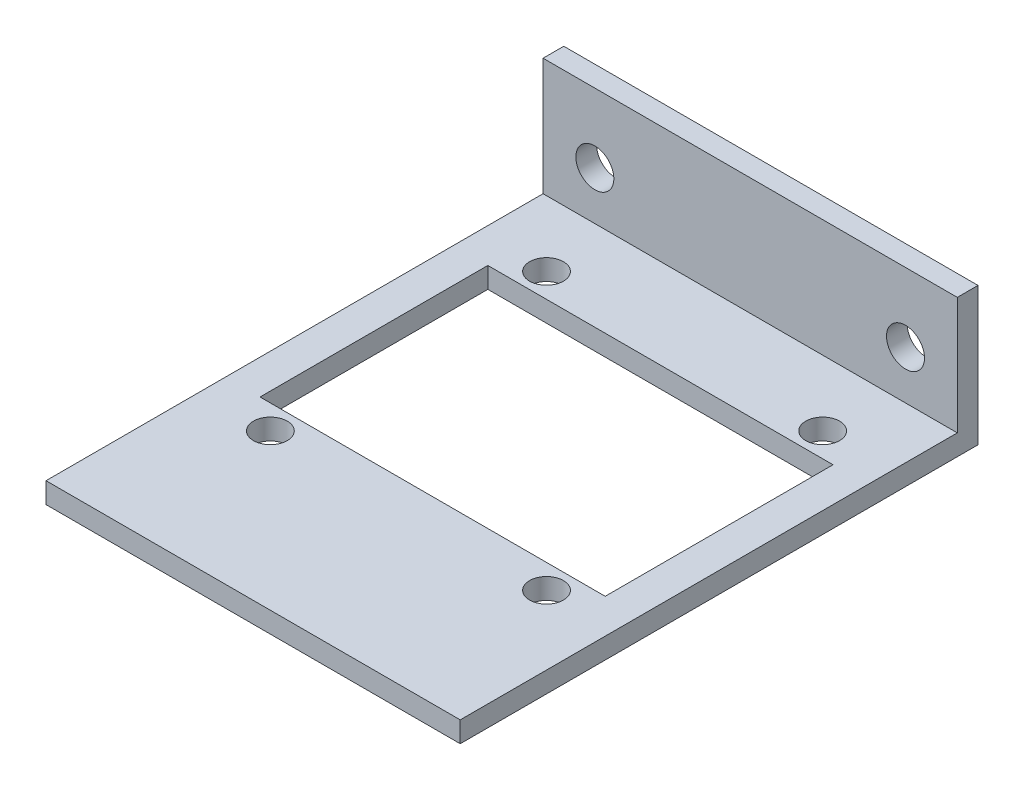
from build123d import *

# Parameters (mm, degrees)
SKETCH1_W            = 60
SKETCH1_H            = 75
BOSS_EXTRUDE1_DEPTH  = 3
SKETCH2_W            = 60
SKETCH2_H            = 3
BOSS_EXTRUDE2_DEPTH  = 17
CUT_EXTRUDE1_REACH   = 52.944
SKETCH3_W            = 50
SKETCH3_H            = 33
CUT_EXTRUDE2_REACH   = 52.944
SKETCH4_R            = 2.45
M5_CLEARANCE_HOLE1_D = 5.5


with BuildPart() as part:
    # Sketch1 → Boss-Extrude1 (new body)
    with BuildSketch(Plane(origin=(0, 0, 0), x_dir=(1, 0, 0), z_dir=(0, 1, 0))):
        Rectangle(SKETCH1_W, SKETCH1_H)
    extrude(amount=BOSS_EXTRUDE1_DEPTH)

    # Sketch2 → Boss-Extrude2 (add)
    with BuildSketch(Plane(origin=(0, 3, 0), x_dir=(1, 0, 0), z_dir=(0, 1, 0))):
        with Locations((0, 36)):
            Rectangle(SKETCH2_W, SKETCH2_H)
    extrude(amount=BOSS_EXTRUDE2_DEPTH)

    # Sketch3 → Cut-Extrude1 (cut, up to next)
    with BuildSketch(Plane(origin=(0, 3, 0), x_dir=(1, 0, 0), z_dir=(0, 1, 0)), mode=Mode.PRIVATE) as cut_extrude1_sk1:
        with Locations((0, 5)):
            Rectangle(SKETCH3_W, SKETCH3_H)
    cut_extrude1_tool1 = extrude(cut_extrude1_sk1.sketch, amount=-CUT_EXTRUDE1_REACH, mode=Mode.PRIVATE) & part.part
    add(cut_extrude1_tool1.solids().sort_by_distance((0, 3, -5))[0], mode=Mode.SUBTRACT)

    # Sketch4 → Cut-Extrude2 (cut, up to next)
    with BuildSketch(Plane(origin=(0, 3, 0), x_dir=(1, 0, 0), z_dir=(0, 1, 0)), mode=Mode.PRIVATE) as cut_extrude2_sk1:
        with Locations(Location((-20, 25, 0), (0, 0, 270))):
            Circle(SKETCH4_R)
    cut_extrude2_tool1 = extrude(cut_extrude2_sk1.sketch, amount=-CUT_EXTRUDE2_REACH, mode=Mode.PRIVATE) & part.part
    # Sketch4 → Cut-Extrude2 (cut, up to next)
    with BuildSketch(Plane(origin=(0, 3, 0), x_dir=(1, 0, 0), z_dir=(0, 1, 0)), mode=Mode.PRIVATE) as cut_extrude2_sk2:
        with Locations(Location((20, 25, 0), (0, 0, 270))):
            Circle(SKETCH4_R)
    cut_extrude2_tool2 = extrude(cut_extrude2_sk2.sketch, amount=-CUT_EXTRUDE2_REACH, mode=Mode.PRIVATE) & part.part
    # Sketch4 → Cut-Extrude2 (cut, up to next)
    with BuildSketch(Plane(origin=(0, 3, 0), x_dir=(1, 0, 0), z_dir=(0, 1, 0)), mode=Mode.PRIVATE) as cut_extrude2_sk3:
        with Locations(Location((20, -15, 0), (0, 0, 270))):
            Circle(SKETCH4_R)
    cut_extrude2_tool3 = extrude(cut_extrude2_sk3.sketch, amount=-CUT_EXTRUDE2_REACH, mode=Mode.PRIVATE) & part.part
    # Sketch4 → Cut-Extrude2 (cut, up to next)
    with BuildSketch(Plane(origin=(0, 3, 0), x_dir=(1, 0, 0), z_dir=(0, 1, 0)), mode=Mode.PRIVATE) as cut_extrude2_sk4:
        with Locations(Location((-20, -15, 0), (0, 0, 270))):
            Circle(SKETCH4_R)
    cut_extrude2_tool4 = extrude(cut_extrude2_sk4.sketch, amount=-CUT_EXTRUDE2_REACH, mode=Mode.PRIVATE) & part.part
    add(cut_extrude2_tool1.solids().sort_by_distance((-20, 3, -25))[0], mode=Mode.SUBTRACT)
    add(cut_extrude2_tool2.solids().sort_by_distance((20, 3, -25))[0], mode=Mode.SUBTRACT)
    add(cut_extrude2_tool3.solids().sort_by_distance((20, 3, 15))[0], mode=Mode.SUBTRACT)
    add(cut_extrude2_tool4.solids().sort_by_distance((-20, 3, 15))[0], mode=Mode.SUBTRACT)

    # M5 Clearance Hole1 (through all)
    with Locations(Plane(origin=(22.5, 10, -37.5), x_dir=(-1, 0, 0), z_dir=(0, 0, -1))):
        with Locations((0, 0), (45, 0)):
            Hole(M5_CLEARANCE_HOLE1_D / 2)


solid = part.part
